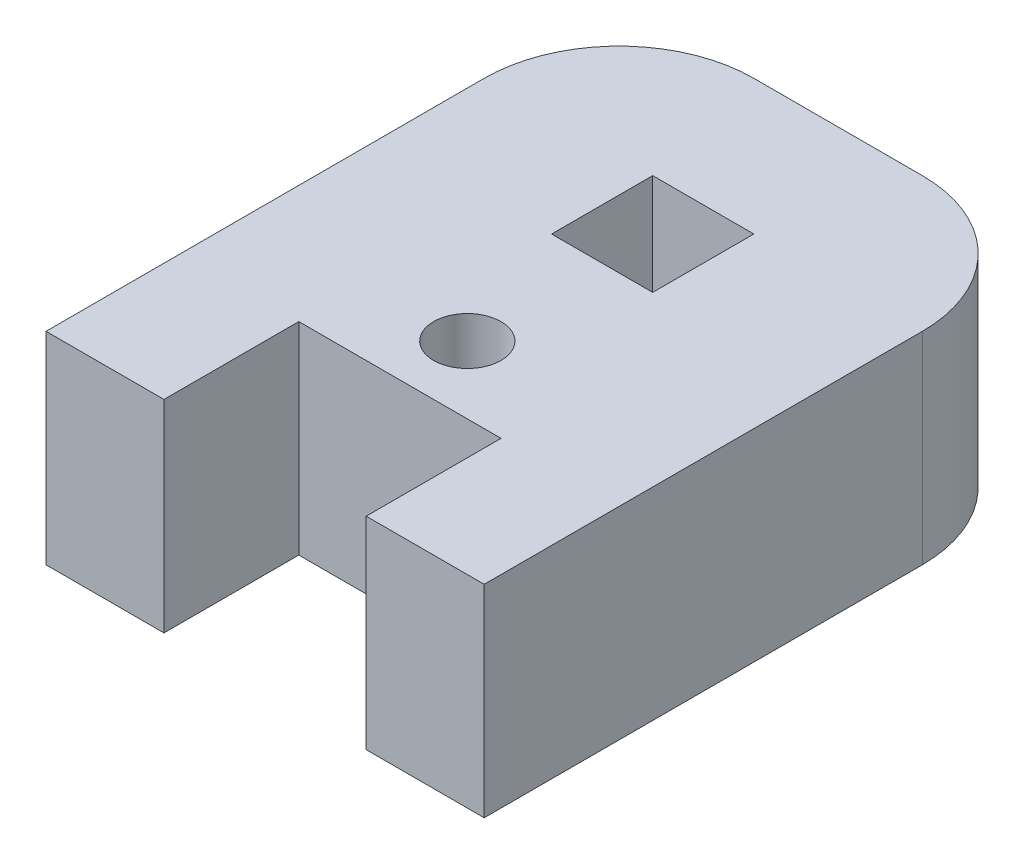
from build123d import *

# Parameters (mm, degrees)
BOSS_EXTRUDE1_DEPTH = 6
SKETCH2_R           = 1
SKETCH2_W           = 3
SKETCH2_H           = 3
CUT_EXTRUDE1_DEPTH  = 23.226110771
FILLET1_R           = 4


with BuildPart() as part:
    # Sketch1 → Boss-Extrude1 (new body)
    with BuildSketch(Plane(origin=(0, 0, 0), x_dir=(1, 0, 0), z_dir=(0, 1, 0))):
        Polygon((3.5, 0), (3.5, 4), (9.5, 4), (9.5, 0), (13, 0), (13, 17), (0, 17), (0, 0), align=None)
    extrude(amount=BOSS_EXTRUDE1_DEPTH)

    # Sketch2 → Cut-Extrude1 (cut, through all)
    with BuildSketch(Plane(origin=(0, 6, 0), x_dir=(1, 0, 0), z_dir=(0, 1, 0))):
        with Locations(Location((6.5, 6, 0), (0, 0, 270))):
            Circle(SKETCH2_R)
        with Locations((6.5, 11.5)):
            Rectangle(SKETCH2_W, SKETCH2_H)
    extrude(amount=-CUT_EXTRUDE1_DEPTH, mode=Mode.SUBTRACT)

    # Fillet1
    fillet1_edges = [part.edges().sort_by_distance(p)[0] for p in [
        (0, 3, -17),
        (13, 3, -17),
    ]]
    fillet(fillet1_edges, radius=FILLET1_R)


solid = part.part
